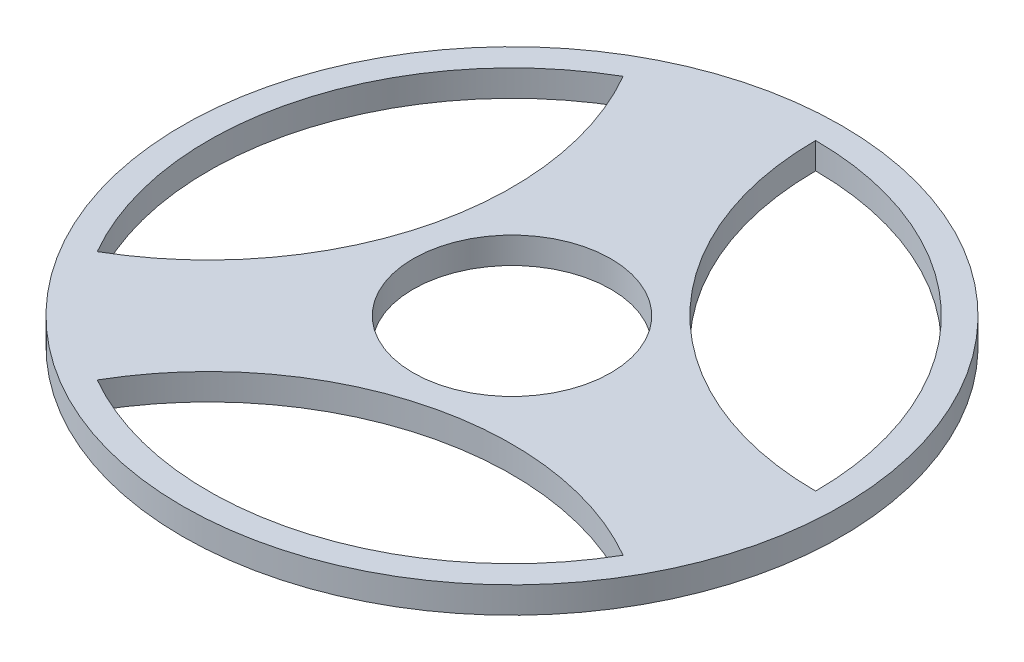
from build123d import *

# Parameters (mm, degrees)
CROQUIS1_R              = 500
CROQUIS1_R_2            = 150
SALIENTE_EXTRUIR1_DEPTH = 40


with BuildPart() as part:
    # Croquis1 → Saliente-Extruir1 (new body)
    with BuildSketch(Plane(origin=(0, 0, 0), x_dir=(1, 0, 0), z_dir=(0, 1, 0))):
        with Locations(Location((0, 0, 0), (0, 0, 270))):
            Circle(CROQUIS1_R)
        with Locations(Location((0, 0, 0), (0, 0, 270))):
            Circle(CROQUIS1_R_2, mode=Mode.SUBTRACT)
        with BuildLine():
            ThreePointArc((-398.931865484, -230.323419925), (-184.304605999, 49.384270339), (-230.323419925, 398.931865484))
            ThreePointArc((-230.323419925, 398.931865484), (-444.95067941, 119.22417522), (-398.931865484, -230.323419925))
        make_face(mode=Mode.SUBTRACT)
        with BuildLine():
            ThreePointArc((398.931865484, -230.323419925), (49.384270339, -184.304605999), (-230.323419925, -398.931865484))
            ThreePointArc((-230.323419925, -398.931865484), (119.22417522, -444.95067941), (398.931865484, -230.323419925))
        make_face(mode=Mode.SUBTRACT)
        with BuildLine():
            ThreePointArc((0, 460.646839851), (134.92033566, 134.92033566), (460.646839851, 0))
            ThreePointArc((460.646839851, 0), (325.726504191, 325.726504191), (0, 460.646839851))
        make_face(mode=Mode.SUBTRACT)
    extrude(amount=SALIENTE_EXTRUIR1_DEPTH)


solid = part.part
